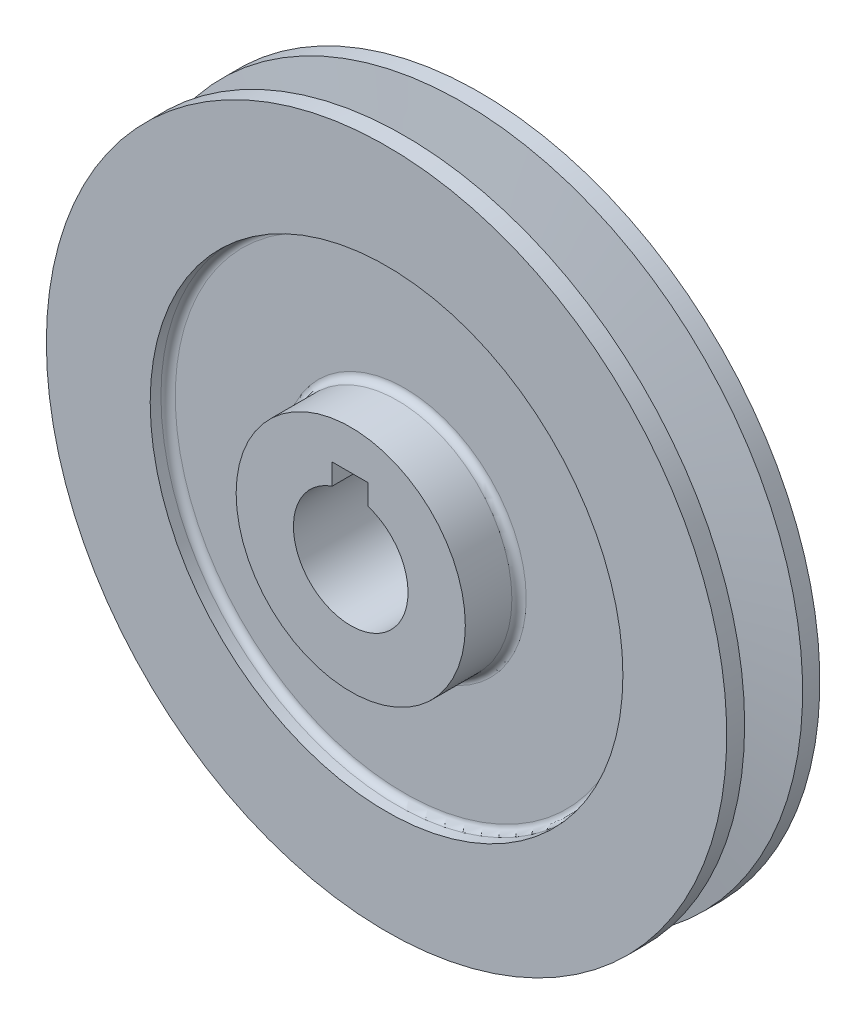
from build123d import *

# Parameters (mm, degrees)
SKETCH1_R               = 47.5
BOSS_EXTRUDE1_DEPTH     = 13
SKETCH2_R               = 33
CUT_EXTRUDE1_DEPTH      = 2.5
CUT_EXTRUDE2_START      = -2.5
SKETCH3_R               = 33
CUT_EXTRUDE2_DEPTH      = 2.5
SKETCH4_R               = 16
BOSS_EXTRUDE2_DEPTH     = 7.5
BOSS_EXTRUDE3_START     = 7.5
SKETCH5_R               = 16
BOSS_EXTRUDE3_DEPTH     = 7.5
SKETCH9_R               = 8
CUT_EXTRUDE3_DEPTH      = 72.003521039
FILLET1_R               = 1
FILLET2_R               = 1
CUT_EXTRUDE5_DEPTH      = 27
CUT_EXTRUDE5_DEPTH_BACK = 17
SKETCH13_W              = 5
SKETCH13_H              = 4.917634469
FILLET3_R               = 1
FILLET4_R               = 1


with BuildPart() as part:
    # Sketch1 → Boss-Extrude1 (new body)
    with BuildSketch(Plane.XY):
        with Locations(Location((0, 0, 0), (0, 0, 180))):
            Circle(SKETCH1_R)
    extrude(amount=BOSS_EXTRUDE1_DEPTH)

    # Sketch2 → Cut-Extrude1 (cut)
    with BuildSketch(Plane.XY.offset(13)):
        Circle(SKETCH2_R)
    extrude(amount=-CUT_EXTRUDE1_DEPTH, mode=Mode.SUBTRACT)

    # Sketch3 → Cut-Extrude2 (cut)
    with BuildSketch(Plane(origin=(0, 0, 0), x_dir=(-1, 0, 0), z_dir=(0, 0, -1)).offset(CUT_EXTRUDE2_START)):
        with Locations(Location((0, 0, 0), (0, 0, 180))):
            Circle(SKETCH3_R)
    extrude(amount=CUT_EXTRUDE2_DEPTH, mode=Mode.SUBTRACT)

    # Sketch4 → Boss-Extrude2 (add)
    with BuildSketch(Plane(origin=(0, 0, 2.5), x_dir=(-1, 0, 0), z_dir=(0, 0, -1))):
        Circle(SKETCH4_R)
    extrude(amount=BOSS_EXTRUDE2_DEPTH)

    # Sketch5 → Boss-Extrude3 (add)
    with BuildSketch(Plane.XY.offset(10.5).offset(BOSS_EXTRUDE3_START)):
        with Locations(Location((0, 0, 0), (0, 0, 180))):
            Circle(SKETCH5_R)
    extrude(amount=-BOSS_EXTRUDE3_DEPTH)

    # Sketch9 → Cut-Extrude3 (cut, through all)
    with BuildSketch(Plane(origin=(0, 0, -5), x_dir=(-1, 0, 0), z_dir=(0, 0, -1))):
        Circle(SKETCH9_R)
    extrude(amount=-CUT_EXTRUDE3_DEPTH, mode=Mode.SUBTRACT)

    # Fillet1
    fillet1_edges = [part.edges().sort_by_distance(p)[0] for p in [
        (16, 0, 2.5),
    ]]
    fillet(fillet1_edges, radius=FILLET1_R)

    # Fillet2
    fillet2_edges = [part.edges().sort_by_distance(p)[0] for p in [
        (16, 0, 10.5),
    ]]
    fillet(fillet2_edges, radius=FILLET2_R)

    # Sketch12 → Cut-Revolve1 (revolve, cut)
    with BuildSketch(Plane(origin=(0, 0, 0), x_dir=(0, 0, -1), z_dir=(1, 0, 0)), mode=Mode.PRIVATE) as cut_revolve1_sk:
        Polygon((-10.5, 47.5), (-8.505134927, 33), (-4.459991863, 33), (-2.40344568, 47.5), align=None)
    revolve(cut_revolve1_sk.sketch.rotate(Axis((0, 0, 31.244121173), (0, 0, -1)), 270), axis=Axis((0, 0, 31.244121173), (0, 0, -1)), mode=Mode.SUBTRACT)

    # Sketch13 → Cut-Extrude5 (cut, two sides: drawn at the far end of the back side and taken through both)
    with BuildSketch(Plane.XY.offset(-CUT_EXTRUDE5_DEPTH_BACK)):
        with Locations((-0.093134084, 8.041182766)):
            Rectangle(SKETCH13_W, SKETCH13_H)
    extrude(amount=CUT_EXTRUDE5_DEPTH + CUT_EXTRUDE5_DEPTH_BACK, mode=Mode.SUBTRACT)

    # Fillet3
    fillet3_edges = [part.edges().sort_by_distance(p)[0] for p in [
        (-33, 0, 2.5),
    ]]
    fillet(fillet3_edges, radius=FILLET3_R)

    # Fillet4
    fillet4_edges = [part.edges().sort_by_distance(p)[0] for p in [
        (-33, 0, 10.5),
    ]]
    fillet(fillet4_edges, radius=FILLET4_R)


solid = part.part
